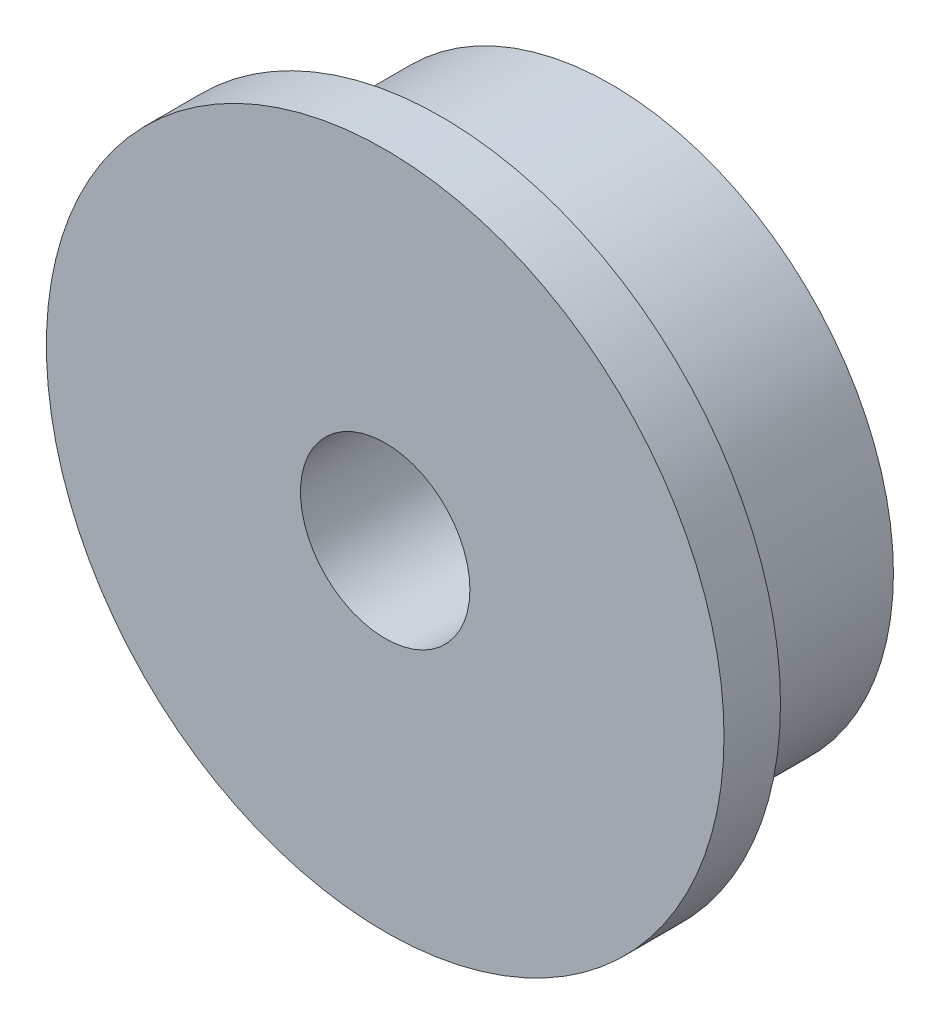
from build123d import *

# Parameters (mm, degrees)
SKETCH_1_R      = 5
SKETCH_1_R_2    = 1.5
EXTRUDE_1_DEPTH = 4
EXTRUDE_START   = -1
SKETCH_2_R      = 6
SKETCH_2_R_2    = 5
EXTRUDE_2_DEPTH = 1


with BuildPart() as part:
    # Эскиз1 → Бобышка-Вытянуть1 (new body)
    with BuildSketch(Plane.XY):
        Circle(SKETCH_1_R)
        Circle(SKETCH_1_R_2, mode=Mode.SUBTRACT)
    extrude(amount=EXTRUDE_1_DEPTH)

    # Эскиз2 → Бобышка-Вытянуть2 (add)
    with BuildSketch(Plane.XY.offset(4).offset(EXTRUDE_START)):
        Circle(SKETCH_2_R)
        Circle(SKETCH_2_R_2, mode=Mode.SUBTRACT)
    extrude(amount=EXTRUDE_2_DEPTH)


solid = part.part
